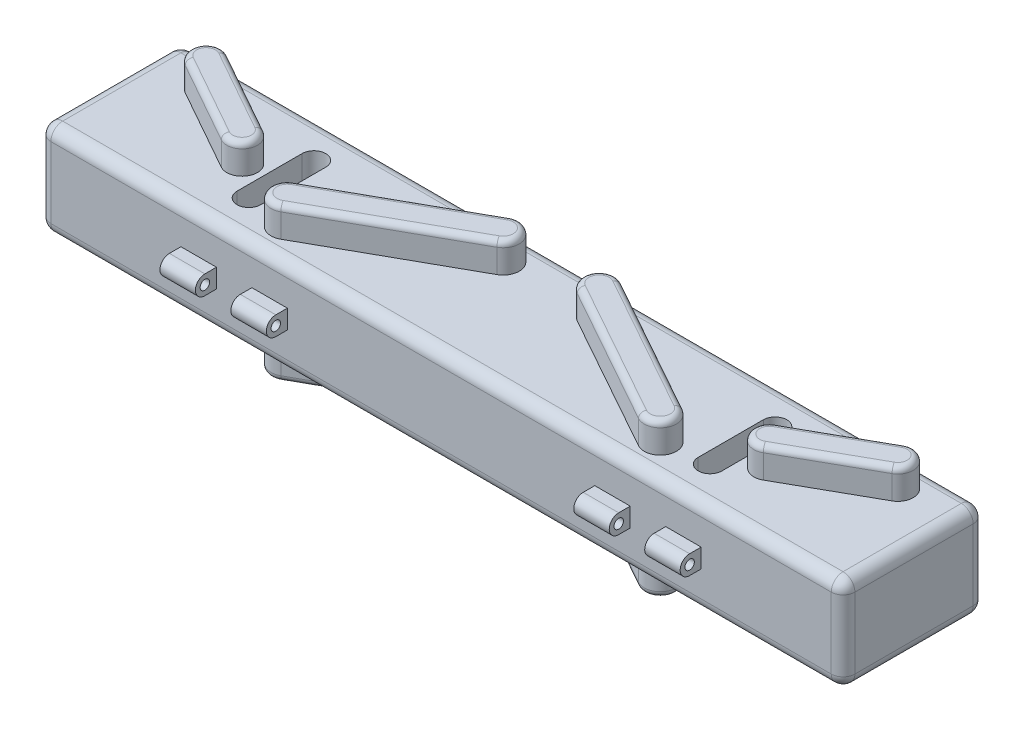
from build123d import *

# Parameters (mm, degrees)
SKETCH_3_W               = 34
SKETCH_3_H               = 6
EXTRUDE_1_DEPTH          = 2
FILLET_1_R               = 0.5
CUT_EXTRUDE_1_DEPTH      = 83.280730143
EXTRUDE_2_DEPTH          = 1.25
FILLET_2_R               = 0.25
FILLET_2_OF_MIRROR_1_R   = 0.25
SKETCH_8_R               = 0.2
EXTRUDE_3_DEPTH          = 15
CUT_EXTRUDE_2_DEPTH      = 173.166247639
CUT_EXTRUDE_2_DEPTH_BACK = 173.166247639
SKETCH_9_W               = 3.029920112
SKETCH_9_H               = 2.410407407
SKETCH_9_W_2             = 1.5
SKETCH_9_H_2             = 3.930732277
SKETCH_9_W_3             = 13
SKETCH_9_W_4             = 2.796364739
SKETCH_9_H_3             = 2.400183936
SKETCH_9_H_4             = 4.42368034


with BuildPart() as part:
    # 草图3 → 凸台-拉伸1 (new, symmetric)
    with BuildSketch(Plane(origin=(0, -148, 0), x_dir=(1, 0, 0), z_dir=(0, 1, 0))):
        with Locations((-65, -2.488037257)):
            Rectangle(SKETCH_3_W, SKETCH_3_H)
    extrude(amount=EXTRUDE_1_DEPTH, both=True)

    # 圆角1
    fillet_1_edges = [part.edges().sort_by_distance(p)[0] for p in [
        (-48, -146, 2.488037257),
        (-65, -146, -0.511962743),
        (-82, -146, 2.488037257),
        (-65, -150, -0.511962743),
        (-48, -150, 2.488037257),
        (-65, -150, 5.488037257),
        (-82, -150, 2.488037257),
        (-82, -148, -0.511962743),
        (-48, -148, -0.511962743),
        (-48, -148, 5.488037257),
        (-82, -148, 5.488037257),
        (-65, -146, 5.488037257),
    ]]
    fillet(fillet_1_edges, radius=FILLET_1_R)

    # 草图6 → 切除-拉伸1 (cut, through all)
    with BuildSketch(Plane.XZ.offset(150)):
        with BuildLine():
            Line((-74.25, 3.863037257), (-74.25, 1.113037257))
            ThreePointArc((-74.25, 1.113037257), (-74.75, 0.613037257), (-75.25, 1.113037257))
            Line((-75.25, 1.113037257), (-75.25, 3.863037257))
            ThreePointArc((-75.25, 3.863037257), (-74.75, 4.363037257), (-74.25, 3.863037257))
        make_face()
        with BuildLine():
            Line((-55.75, 3.863037257), (-55.75, 1.113037257))
            ThreePointArc((-55.75, 1.113037257), (-55.25, 0.613037257), (-54.75, 1.113037257))
            Line((-54.75, 1.113037257), (-54.75, 3.863037257))
            ThreePointArc((-54.75, 3.863037257), (-55.25, 4.363037257), (-55.75, 3.863037257))
        make_face()
    extrude(amount=-CUT_EXTRUDE_1_DEPTH, mode=Mode.SUBTRACT)

    # 草图7 → 凸台-拉伸2 (add)
    with BuildSketch(Plane.XZ.offset(150)):
        with BuildLine():
            Line((-73.221745141, 3.514990742), (-67.357958899, 0.241318572))
            ThreePointArc((-67.357958899, 0.241318572), (-66.434608194, 0.503052584), (-66.696342207, 1.426403289))
            Line((-66.696342207, 1.426403289), (-72.560128449, 4.700075459))
            ThreePointArc((-72.560128449, 4.700075459), (-73.483479153, 4.438341447), (-73.221745141, 3.514990742))
        make_face()
        with BuildLine():
            Line((-76.460485816, 3.320619004), (-79.94626103, 1.360805471))
            ThreePointArc((-79.94626103, 1.360805471), (-80.193043535, 0.48013065), (-79.312368713, 0.233348145))
            Line((-79.312368713, 0.233348145), (-75.826593499, 2.193161677))
            ThreePointArc((-75.826593499, 2.193161677), (-75.579810994, 3.073836499), (-76.460485816, 3.320619004))
        make_face()
        with BuildLine():
            ThreePointArc((-62.642041101, 0.241318572), (-63.565391806, 0.503052584), (-63.303657793, 1.426403289))
            Line((-63.303657793, 1.426403289), (-57.439871551, 4.700075459))
            ThreePointArc((-57.439871551, 4.700075459), (-56.516520847, 4.438341447), (-56.778254859, 3.514990742))
            Line((-56.778254859, 3.514990742), (-62.642041101, 0.241318572))
        make_face()
        with BuildLine():
            ThreePointArc((-50.05373897, 1.360805471), (-49.806956465, 0.48013065), (-50.687631287, 0.233348145))
            Line((-50.687631287, 0.233348145), (-54.173406501, 2.193161677))
            ThreePointArc((-54.173406501, 2.193161677), (-54.420189006, 3.073836499), (-53.539514184, 3.320619004))
            Line((-53.539514184, 3.320619004), (-50.05373897, 1.360805471))
        make_face()
    extrude_2 = extrude(amount=EXTRUDE_2_DEPTH)

    # 圆角2
    fillet_2_edges = [part.edges().sort_by_distance(p)[0] for p in [
        (-69.628235328, -151.25, 3.063239374),
        (-70.28985202, -151.25, 1.878154657),
        (-66.434608194, -151.25, 0.503052584),
        (-73.483479153, -151.25, 4.438341447),
        (-77.569481106, -151.25, 1.213254911),
        (-78.203373423, -151.25, 2.340712237),
        (-80.193043535, -151.25, 0.48013065),
        (-75.579810994, -151.25, 3.073836499),
        (-63.565391806, -151.25, 0.503052584),
        (-59.71014798, -151.25, 1.878154657),
        (-56.516520847, -151.25, 4.438341447),
        (-60.371764672, -151.25, 3.063239374),
        (-49.806956465, -151.25, 0.48013065),
        (-51.796626577, -151.25, 2.340712237),
        (-54.420189006, -151.25, 3.073836499),
        (-52.430518894, -151.25, 1.213254911),
    ]]
    fillet(fillet_2_edges, radius=FILLET_2_R)

    # 镜向1: 凸台-拉伸2 across plane
    add(extrude_2.mirror(Plane(origin=(0, -148, 0), x_dir=(0, 0, 1), z_dir=(0, -1, 0))))

    # 圆角2 of 镜向1
    fillet_2_of_mirror_1_edges = [part.edges().sort_by_distance(p)[0] for p in [
        (-69.628235328, -144.75, 3.063239374),
        (-70.28985202, -144.75, 1.878154657),
        (-66.434608194, -144.75, 0.503052584),
        (-73.483479153, -144.75, 4.438341447),
        (-77.569481106, -144.75, 1.213254911),
        (-78.203373423, -144.75, 2.340712237),
        (-80.193043535, -144.75, 0.48013065),
        (-75.579810994, -144.75, 3.073836499),
        (-63.565391806, -144.75, 0.503052584),
        (-59.71014798, -144.75, 1.878154657),
        (-56.516520847, -144.75, 4.438341447),
        (-60.371764672, -144.75, 3.063239374),
        (-49.806956465, -144.75, 0.48013065),
        (-51.796626577, -144.75, 2.340712237),
        (-54.420189006, -144.75, 3.073836499),
        (-52.430518894, -144.75, 1.213254911),
    ]]
    fillet(fillet_2_of_mirror_1_edges, radius=FILLET_2_OF_MIRROR_1_R)

    # 草图8 → 凸台-拉伸3 (add, symmetric)
    with BuildSketch(Plane(origin=(-65, 0, 0), x_dir=(0, 0, -1), z_dir=(1, 0, 0))):
        with BuildLine():
            Line((1, -148.4), (-5.976074513, -148.4))
            ThreePointArc((-5.976074513, -148.4), (-6.376074513, -148), (-5.976074513, -147.6))
            Line((-5.976074513, -147.6), (1, -147.6))
            ThreePointArc((1, -147.6), (1.4, -148), (1, -148.4))
        make_face()
        with Locations((1, -148)):
            Circle(SKETCH_8_R, mode=Mode.SUBTRACT)
        with Locations((-5.976074513, -148)):
            Circle(SKETCH_8_R, mode=Mode.SUBTRACT)
    extrude(amount=EXTRUDE_3_DEPTH, both=True)

    # 草图9 → 切除-拉伸2 (cut, two sides: drawn at the far end of the back side and taken through both)
    with BuildSketch(Plane(origin=(0, 0, 0), x_dir=(1, 0, 0), z_dir=(0, 1, 0)).offset(-CUT_EXTRUDE_2_DEPTH_BACK)):
        with Locations((-79.014960056, 1.717166447)):
            Rectangle(SKETCH_9_W, SKETCH_9_H)
        with Locations((-75.25, 2.477328882)):
            Rectangle(SKETCH_9_W_2, SKETCH_9_H_2)
        with Locations((-72.25, 2.477328882)):
            Rectangle(SKETCH_9_W_2, SKETCH_9_H_2)
        with Locations((-65, 2.477328882)):
            Rectangle(SKETCH_9_W_3, SKETCH_9_H_2)
        with Locations((-57.75, 2.477328882)):
            Rectangle(SKETCH_9_W_2, SKETCH_9_H_2)
        with Locations((-54.75, 2.477328882)):
            Rectangle(SKETCH_9_W_2, SKETCH_9_H_2)
        with Locations((-51.101817631, 1.717166447)):
            Rectangle(SKETCH_9_W_4, SKETCH_9_H)
        with Locations((-51.101817631, -6.688129225)):
            Rectangle(SKETCH_9_W_4, SKETCH_9_H_3)
        Polygon((-52.5, -5.488037257), (-54, -5.488037257), (-54, -9.911717597), (-52.5, -9.911717597), (-52.5, -7.888221193), align=None)
        with Locations((-56.25, -7.699877427)):
            Rectangle(SKETCH_9_W_2, SKETCH_9_H_4)
        with Locations((-65, -7.699877427)):
            Rectangle(SKETCH_9_W_3, SKETCH_9_H_4)
        with Locations((-73.75, -7.699877427)):
            Rectangle(SKETCH_9_W_2, SKETCH_9_H_4)
        Polygon((-76, -9.911717597), (-76, -5.488037257), (-77.5, -5.488037257), (-77.5, -7.888221193), (-77.5, -9.911717597), align=None)
        with Locations((-79.014960056, -6.688129225)):
            Rectangle(SKETCH_9_W, SKETCH_9_H_3)
    extrude(amount=CUT_EXTRUDE_2_DEPTH + CUT_EXTRUDE_2_DEPTH_BACK, mode=Mode.SUBTRACT)


solid = part.part
